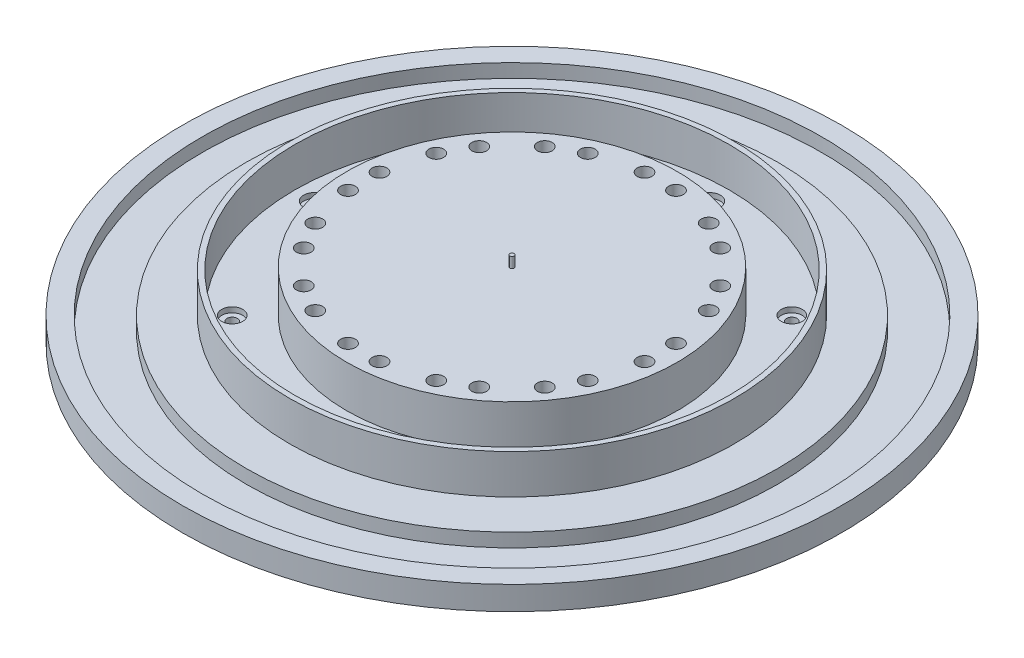
from build123d import *

# Parameters (mm, degrees)
SKETCH6_R           = 10
CUT_EXTRUDE2_DEPTH  = 5
SKETCH7_R           = 5
CUT_EXTRUDE3_DEPTH  = 447.09219899
SKETCH8_R           = 157.5
BOSS_EXTRUDE1_DEPTH = 40
SKETCH9_R           = 7
CUT_EXTRUDE4_DEPTH  = 35
CIRPATTERN1_COUNT   = 12
SKETCH10_R          = 2.000359625
BOSS_EXTRUDE2_DEPTH = 10


with BuildPart() as part:
    # Sketch3 → Revolve1 (revolve)
    with BuildSketch(Plane(origin=(0, 0, 0), x_dir=(0, 0, -1), z_dir=(1, 0, 0))):
        Polygon((-212, 8.070339729), (-212, 45.570339729), (-207, 45.570339729), (-207, 8.070339729), (-0.848831398, 8.070339729), (-0.848831398, 11.780945064), (0, 11.780945064), (0, 8.070339729), (0, -14.429660271), (-314, -14.429660271), (-314, 8.070339729), (-295, 8.070339729), (-295, -4.929660271), (-253, -4.929660271), (-253, 8.070339729), align=None)
    revolve(axis=Axis((0, 120.738006406, 0), (0, -1, 0)))

    # Sketch6 → Cut-Extrude2 (cut)
    with BuildSketch(Plane(origin=(0, 8.070339729, 0), x_dir=(1, 0, 0), z_dir=(0, 1, 0))):
        with Locations(Location((-133.289628254, 133.289628254, 0), (0, 0, 270))):
            Circle(SKETCH6_R)
        with Locations(Location((133.289628254, 133.289628254, 0), (0, 0, 270))):
            Circle(SKETCH6_R)
        with Locations(Location((-133.289628254, -133.289628254, 0), (0, 0, 90))):
            Circle(SKETCH6_R)
        with Locations(Location((133.289628254, -133.289628254, 0), (0, 0, 90))):
            Circle(SKETCH6_R)
        with Locations(Location((0, 188.5, 0), (0, 0, 270))):
            Circle(SKETCH6_R)
        with Locations(Location((188.5, 0, 0), (0, 0, 270))):
            Circle(SKETCH6_R)
        with Locations(Location((0, -188.5, 0), (0, 0, 90))):
            Circle(SKETCH6_R)
        with Locations(Location((-188.5, 0, 0), (0, 0, 90))):
            Circle(SKETCH6_R)
    extrude(amount=-CUT_EXTRUDE2_DEPTH, mode=Mode.SUBTRACT)

    # Sketch7 → Cut-Extrude3 (cut, through all)
    with BuildSketch(Plane(origin=(0, 3.070339729, 0), x_dir=(1, 0, 0), z_dir=(0, 1, 0))):
        with Locations(Location((0, 188.5, 0), (0, 0, 270))):
            Circle(SKETCH7_R)
        with Locations(Location((133.289628254, 133.289628254, 0), (0, 0, 270))):
            Circle(SKETCH7_R)
        with Locations(Location((-133.289628254, 133.289628254, 0), (0, 0, 90))):
            Circle(SKETCH7_R)
        with Locations(Location((188.5, 0, 0), (0, 0, 90))):
            Circle(SKETCH7_R)
        with Locations(Location((133.289628254, -133.289628254, 0), (0, 0, 90))):
            Circle(SKETCH7_R)
        with Locations(Location((0, -188.5, 0), (0, 0, 90))):
            Circle(SKETCH7_R)
        with Locations(Location((-188.5, 0, 0), (0, 0, 270))):
            Circle(SKETCH7_R)
        with Locations(Location((-133.289628254, -133.289628254, 0), (0, 0, 270))):
            Circle(SKETCH7_R)
    extrude(amount=-CUT_EXTRUDE3_DEPTH, mode=Mode.SUBTRACT)

    # Sketch8 → Boss-Extrude1 (add)
    with BuildSketch(Plane(origin=(0, 8.070339729, 0), x_dir=(1, 0, 0), z_dir=(0, 1, 0))):
        with Locations(Location((0, 0, 0), (0, 0, 270))):
            Circle(SKETCH8_R)
    extrude(amount=BOSS_EXTRUDE1_DEPTH)

    # Sketch9 → Cut-Extrude4 (cut)
    with BuildSketch(Plane(origin=(0, 48.070339729, 0), x_dir=(1, 0, 0), z_dir=(0, 1, 0))):
        with Locations(Location((-15, 141.25, 0), (0, 0, 270))):
            Circle(SKETCH9_R)
        with Locations(Location((15, 141.25, 0), (0, 0, 270))):
            Circle(SKETCH9_R)
    cut_extrude4 = extrude(amount=-CUT_EXTRUDE4_DEPTH, mode=Mode.SUBTRACT)

    # CirPattern1: Cut-Extrude4 ×12 about axis
    cirpattern1_axis = Axis((0, 0, 0), (0, 1, 0))
    for i in range(1, CIRPATTERN1_COUNT):
        add(cut_extrude4.rotate(cirpattern1_axis, i * 360 / CIRPATTERN1_COUNT), mode=Mode.SUBTRACT)

    # Sketch10 → Boss-Extrude2 (add)
    with BuildSketch(Plane(origin=(0, 48.070339729, 0), x_dir=(1, 0, 0), z_dir=(0, 1, 0))):
        with Locations(Location((0, 0, 0), (0, 0, 270))):
            Circle(SKETCH10_R)
    extrude(amount=BOSS_EXTRUDE2_DEPTH)


solid = part.part
